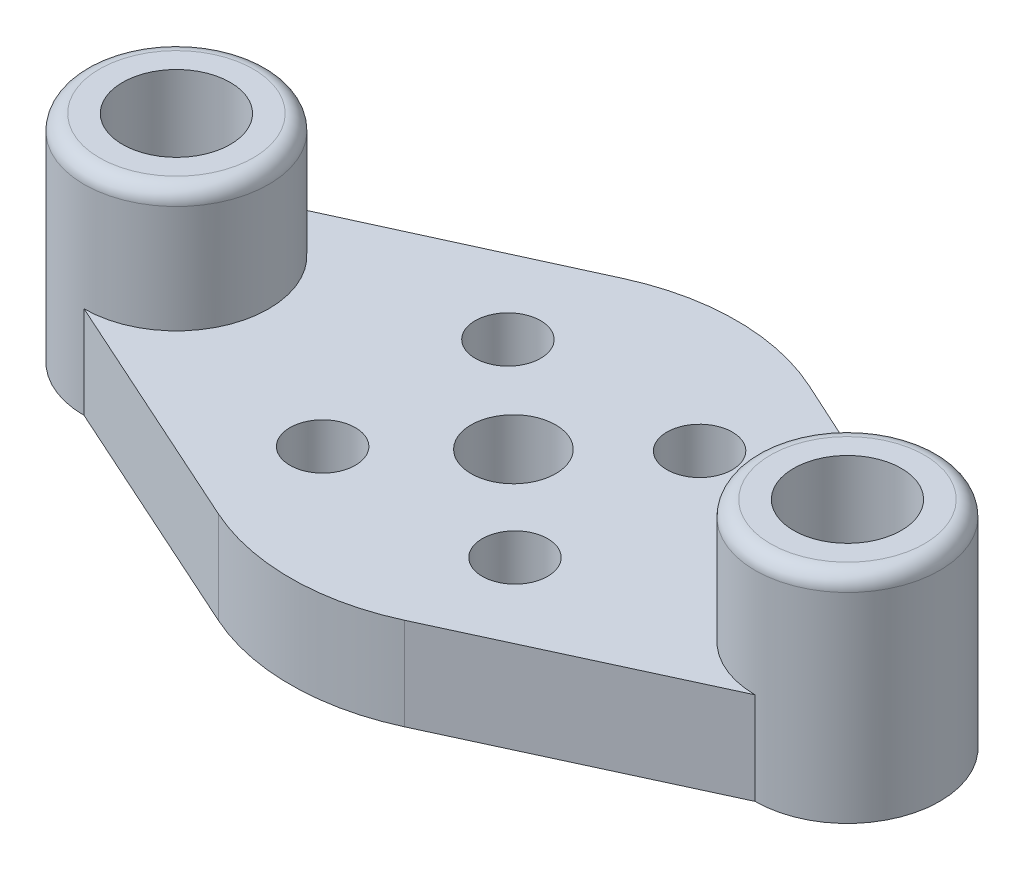
from build123d import *

# Parameters (mm, degrees)
ESBO_O2_R                = 4.25
ESBO_O2_R_2              = 5.5
ESBO_O2_R_3              = 7
RESSALTO_EXTRUS_O2_DEPTH = 12
ESBO_O3_R                = 12
ESBO_O3_R_2              = 7
RESSALTO_EXTRUS_O3_DEPTH = 16
FILETE1_R                = 2


with BuildPart() as part:
    # Esboço2 → Ressalto-extrusão2 (new body)
    with BuildSketch(Plane(origin=(0, 0, 0), x_dir=(1, 0, 0), z_dir=(0, 1, 0))):
        with BuildLine():
            Line((-12.057610331, 26.374495883), (-43.708926586, 11.904485175))
            ThreePointArc((-43.708926586, 11.904485175), (-55.708926586, -0.095514825), (-43.708926586, -12.095514825))
            Line((-43.708926586, -12.095514825), (-11.925771547, -26.434371054))
            ThreePointArc((-11.925771547, -26.434371054), (0.12376622, -28.999735894), (12.150968312, -26.331615391))
            Line((12.150968312, -26.331615391), (43.35338336, -11.93297137))
            ThreePointArc((43.35338336, -11.93297137), (55.35338336, 0.06702863), (43.35338336, 12.06702863))
            Line((43.35338336, 12.06702863), (12.057610331, 26.374495883))
            ThreePointArc((12.057610331, 26.374495883), (0, 29), (-12.057610331, 26.374495883))
        make_face()
        with Locations(Location((-12.714926554, -12.082390656, 0), (0, 0, 90))):
            Circle(ESBO_O2_R, mode=Mode.SUBTRACT)
        with Locations(Location((12.285073446, -12.082390656, 0), (0, 0, 90))):
            Circle(ESBO_O2_R, mode=Mode.SUBTRACT)
        with Locations(Location((0, 0, 0), (0, 0, 90))):
            Circle(ESBO_O2_R_2, mode=Mode.SUBTRACT)
        with Locations(Location((-12.714788426, 12.000714001, 0), (0, 0, 90))):
            Circle(ESBO_O2_R, mode=Mode.SUBTRACT)
        with Locations(Location((12.285073446, 11.917609344, 0), (0, 0, 90))):
            Circle(ESBO_O2_R, mode=Mode.SUBTRACT)
        with Locations(Location((-43.708926586, -0.095514825, 0), (0, 0, 90))):
            Circle(ESBO_O2_R_3, mode=Mode.SUBTRACT)
        with Locations(Location((43.35338336, 0.06702863, 0), (0, 0, 90))):
            Circle(ESBO_O2_R_3, mode=Mode.SUBTRACT)
    extrude(amount=RESSALTO_EXTRUS_O2_DEPTH)

    # Esboço3 → Ressalto-extrusão3 (add)
    # profile 1 of 2: a face of its own
    with BuildSketch(Plane(origin=(0, 12, 0), x_dir=(1, 0, 0), z_dir=(0, 1, 0))):
        with Locations(Location((-43.708926586, -0.095514825, 0), (0, 0, 270))):
            Circle(ESBO_O3_R)
        with Locations(Location((-43.708926586, -0.095514825, 0), (0, 0, 90))):
            Circle(ESBO_O3_R_2, mode=Mode.SUBTRACT)
    # profile 2 of 2: a face of its own
    with BuildSketch(Plane(origin=(0, 12, 0), x_dir=(1, 0, 0), z_dir=(0, 1, 0))):
        with Locations(Location((43.35338336, 0.06702863, 0), (0, 0, 270))):
            Circle(ESBO_O3_R)
        with Locations(Location((43.35338336, 0.06702863, 0), (0, 0, 90))):
            Circle(ESBO_O3_R_2, mode=Mode.SUBTRACT)
    extrude(amount=RESSALTO_EXTRUS_O3_DEPTH)

    # Filete1
    filete1_edges = [part.edges().sort_by_distance(p)[0] for p in [
        (-43.708926586, 28, -11.904485175),
        (43.35338336, 28, -12.06702863),
    ]]
    fillet(filete1_edges, radius=FILETE1_R)


solid = part.part
